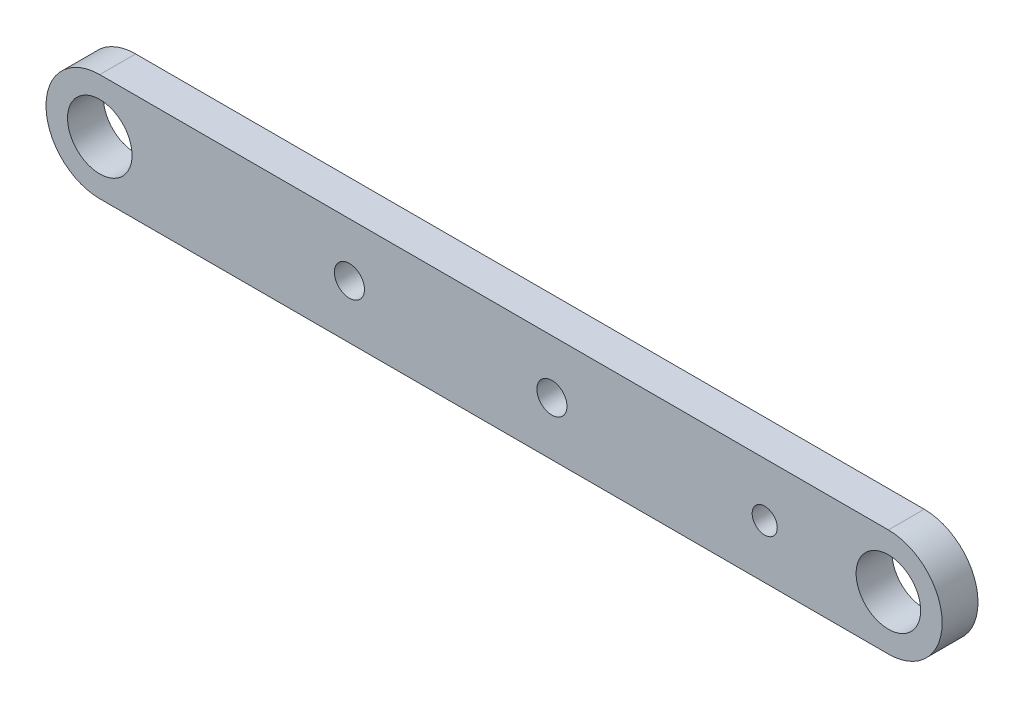
from build123d import *

# Parameters (mm, degrees)
ESQUISSE1_R        = 4.5
ESQUISSE1_R_2      = 2.1
ESQUISSE1_R_3      = 1.75
BOSS_EXTRU_1_DEPTH = 5


with BuildPart() as part:
    # Esquisse1 → Boss.-Extru.1 (new body)
    with BuildSketch(Plane.XY):
        with BuildLine():
            Line((-110, 7.5), (0, 7.5))
            ThreePointArc((0, 7.5), (7.5, 0), (0, -7.5))
            Line((0, -7.5), (-110, -7.5))
            ThreePointArc((-110, -7.5), (-117.5, 0), (-110, 7.5))
        make_face()
        Circle(ESQUISSE1_R, mode=Mode.SUBTRACT)
        with Locations((-110, 0)):
            Circle(ESQUISSE1_R, mode=Mode.SUBTRACT)
        with Locations((-75.18, 0)):
            Circle(ESQUISSE1_R_2, mode=Mode.SUBTRACT)
        with Locations((-46.93, 0)):
            Circle(ESQUISSE1_R_2, mode=Mode.SUBTRACT)
        with Locations((-17.25, 0)):
            Circle(ESQUISSE1_R_3, mode=Mode.SUBTRACT)
    extrude(amount=BOSS_EXTRU_1_DEPTH)


solid = part.part
